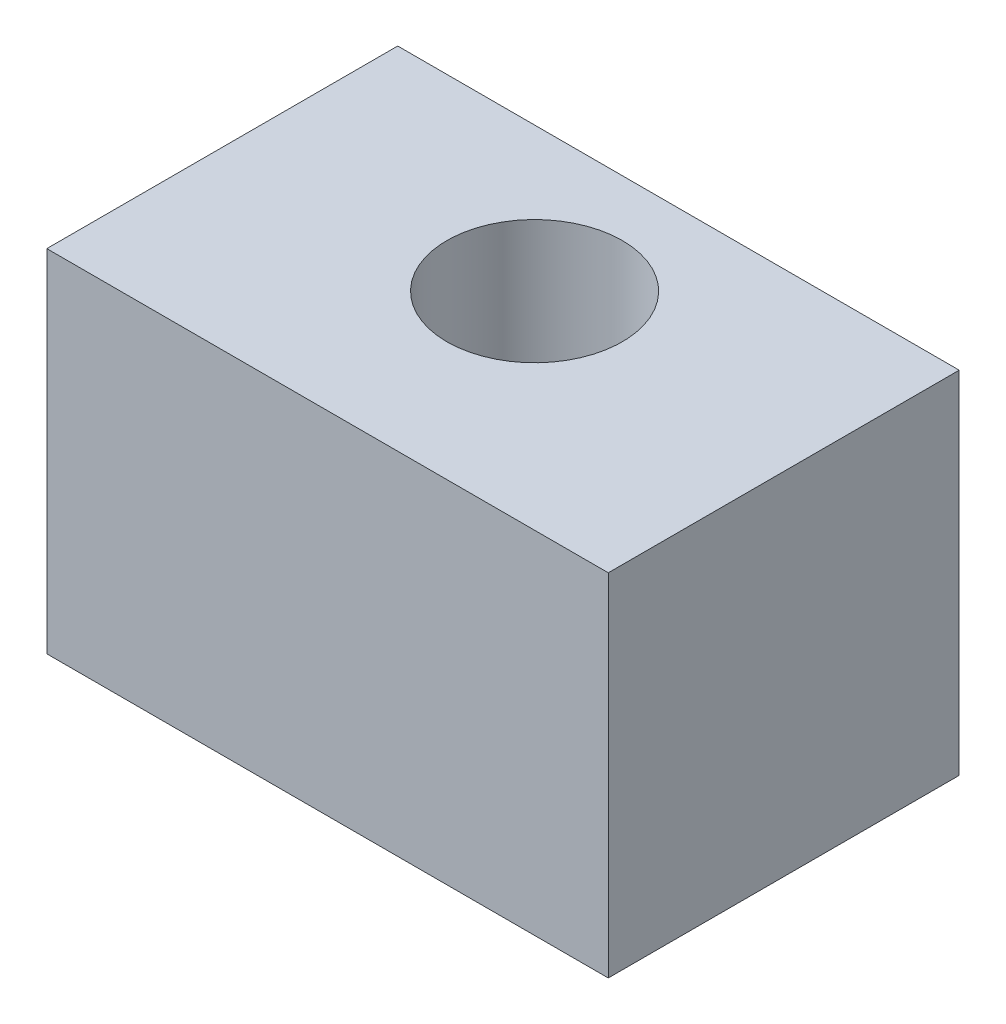
from build123d import *

# Parameters (mm, degrees)
SKETCH1_W           = 16
SKETCH1_H           = 10
SKETCH1_R           = 2.5
BOSS_EXTRUDE1_DEPTH = 10


with BuildPart() as part:
    # Sketch1 → Boss-Extrude1 (new body)
    with BuildSketch(Plane(origin=(0, 0, 0), x_dir=(1, 0, 0), z_dir=(0, 1, 0))):
        with Locations((8, 5)):
            Rectangle(SKETCH1_W, SKETCH1_H)
        with Locations(Location((8, 5.9, 0), (0, 0, 270))):
            Circle(SKETCH1_R, mode=Mode.SUBTRACT)
    extrude(amount=BOSS_EXTRUDE1_DEPTH)


solid = part.part
